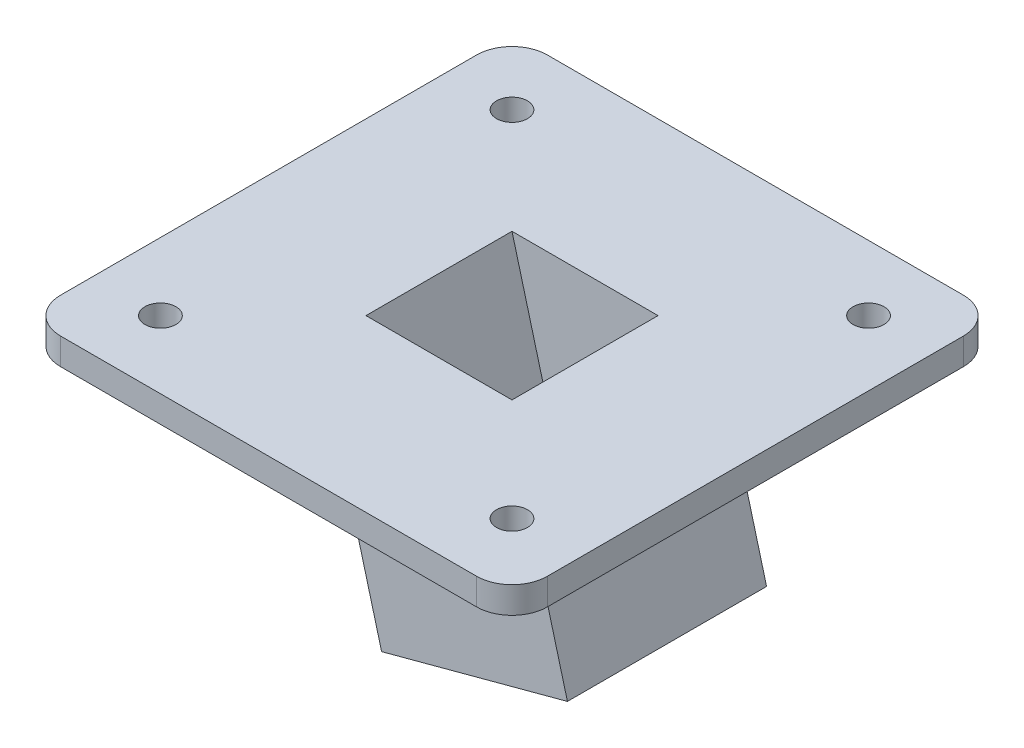
from build123d import *

# Parameters (mm, degrees)
SKETCH1_W                       = 55
SKETCH1_H                       = 55
SKETCH1_R                       = 1.75
BOSS_EXTRUDE1_DEPTH             = 3
BOSS_EXTRUDE3_REACH             = 67.033
SKETCH7_W                       = 21.733331091
SKETCH7_H                       = 22.5
SKETCH7_W_2                     = 15.937776134
SKETCH7_H_2                     = 16.5
BOSS_EXTRUDE3_DIRECTION_2_DEPTH = 11
SKETCH8_W                       = 15.937776134
SKETCH8_H                       = 16.5
CUT_EXTRUDE2_DEPTH              = 30
FILLET3_R                       = 4


with BuildPart() as part:
    # Sketch1 → Boss-Extrude1 (new body)
    with BuildSketch(Plane(origin=(0, 0, 0), x_dir=(1, 0, 0), z_dir=(0, 1, 0))):
        Rectangle(SKETCH1_W, SKETCH1_H)
        with Locations(Location((20.140368527, 20.140368527, 0), (0, 0, 270))):
            Circle(SKETCH1_R, mode=Mode.SUBTRACT)
        with Locations(Location((-19.859631473, -19.859631473, 0), (0, 0, 270))):
            Circle(SKETCH1_R, mode=Mode.SUBTRACT)
        with Locations(Location((-20.140368527, 20.140368527, 0), (0, 0, 90))):
            Circle(SKETCH1_R, mode=Mode.SUBTRACT)
        with Locations(Location((19.859631473, -19.859631473, 0), (0, 0, 90))):
            Circle(SKETCH1_R, mode=Mode.SUBTRACT)
    extrude(amount=BOSS_EXTRUDE1_DEPTH)

    # Boss-Extrude3: up to this plane
    boss_extrude3_end = Plane(origin=(0, 0, 0), z_dir=(0, 1, 0))
    # Sketch7 → Boss-Extrude3 (add, up to the surface)
    with BuildSketch(Plane(origin=(3.41851723, -12.758079989, 27.5), x_dir=(0.9659258262890681, 0.25881904510252174, 0), z_dir=(-0.25881904510252174, 0.9659258262890681, 0)), mode=Mode.PRIVATE) as boss_extrude3_sk1:
        with Locations((0.776457136, 27.5)):
            Rectangle(SKETCH7_W, SKETCH7_H)
        with Locations((0.776457135, 27.5)):
            Rectangle(SKETCH7_W_2, SKETCH7_H_2, mode=Mode.SUBTRACT)
    boss_extrude3_tool1 = split(extrude(boss_extrude3_sk1.sketch, amount=BOSS_EXTRUDE3_REACH, mode=Mode.PRIVATE), bisect_by=boss_extrude3_end, keep=Keep.BOTH, mode=Mode.PRIVATE)
    add(boss_extrude3_tool1.solids().sort_by_distance((4.168517, -12.557118, 10.937176))[0])

    # Sketch7 → Boss-Extrude3 direction 2 (add)
    with BuildSketch(Plane(origin=(3.41851723, -12.758079989, 27.5), x_dir=(0.9659258262890681, 0.25881904510252174, 0), z_dir=(-0.25881904510252174, 0.9659258262890681, 0))):
        with Locations((0.776457136, 27.5)):
            Rectangle(SKETCH7_W, SKETCH7_H)
        with Locations((0.776457135, 27.5)):
            Rectangle(SKETCH7_W_2, SKETCH7_H_2, mode=Mode.SUBTRACT)
    extrude(amount=-BOSS_EXTRUDE3_DIRECTION_2_DEPTH)

    # Sketch8 → Cut-Extrude2 (cut)
    with BuildSketch(Plane(origin=(6.265526726, -23.383264078, 0), x_dir=(0.9659258262890681, 0.2588190451025216, 0), z_dir=(0.2588190451025216, -0.9659258262890681, 0))):
        with Locations((0.776457135, 0)):
            Rectangle(SKETCH8_W, SKETCH8_H)
    extrude(amount=-CUT_EXTRUDE2_DEPTH, mode=Mode.SUBTRACT)

    # Fillet3
    fillet3_edges = [part.edges().sort_by_distance(p)[0] for p in [
        (0.803847577, 0, 11.25),
        (12.053847577, 0, 0),
        (0.803847577, 0, -11.25),
        (-10.446152423, 0, 0),
        (27.5, 1.5, 27.5),
        (-27.5, 1.5, 27.5),
        (-27.5, 1.5, -27.5),
        (27.5, 1.5, -27.5),
    ]]
    fillet(fillet3_edges, radius=FILLET3_R)


solid = part.part
